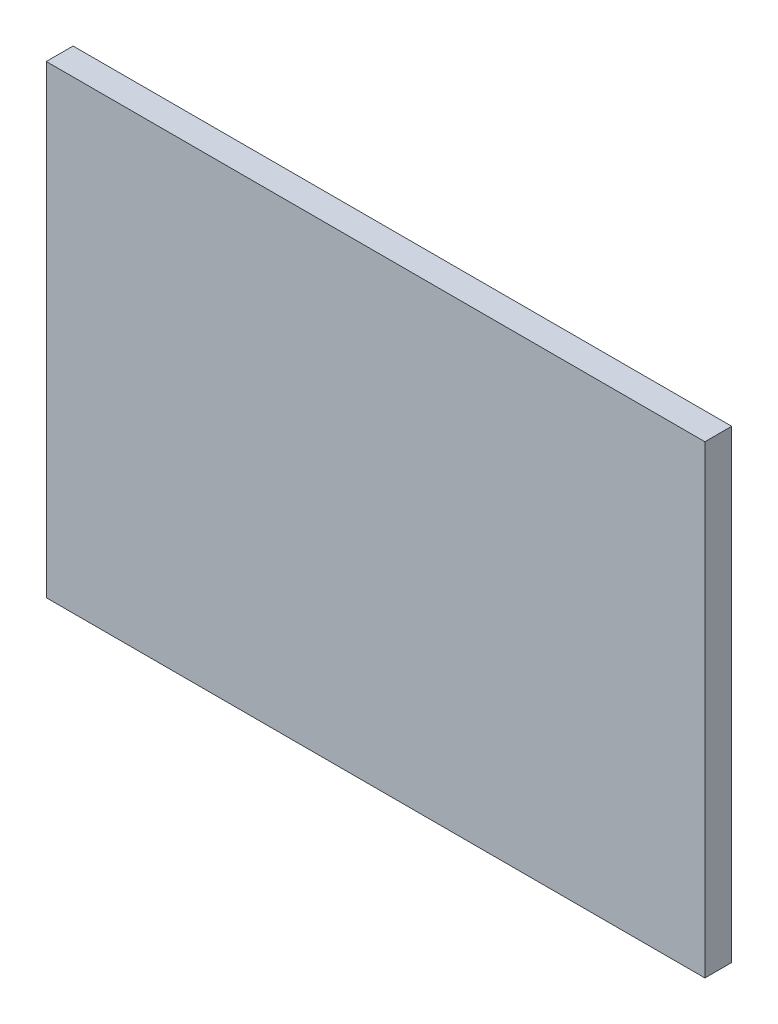
from build123d import *

# Parameters (mm, degrees)
SKETCH1_W           = 39
SKETCH1_H           = 27.5
BOSS_EXTRUDE1_DEPTH = 1.5875


with BuildPart() as part:
    # Sketch1 → Boss-Extrude1 (new body)
    with BuildSketch(Plane.XY):
        Rectangle(SKETCH1_W, SKETCH1_H)
    extrude(amount=BOSS_EXTRUDE1_DEPTH)


solid = part.part
